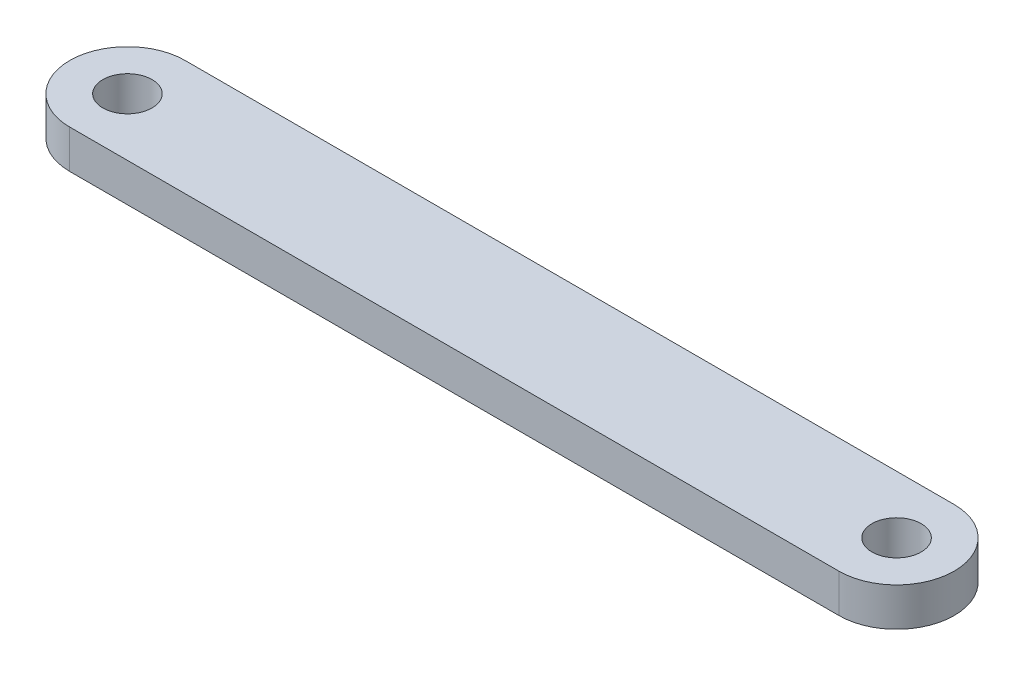
from build123d import *

# Parameters (mm, degrees)
SKETCH1_R           = 2.032
BOSS_EXTRUDE1_DEPTH = 3.175


with BuildPart() as part:
    # Sketch1 → Boss-Extrude1 (new body)
    with BuildSketch(Plane(origin=(0, 0, 0), x_dir=(1, 0, 0), z_dir=(0, 1, 0))):
        with BuildLine():
            Line((0, -4.7625), (-63.5, -4.7625))
            ThreePointArc((-63.5, -4.7625), (-68.2625, 0), (-63.5, 4.7625))
            Line((-63.5, 4.7625), (0, 4.7625))
            ThreePointArc((0, 4.7625), (4.7625, 0), (0, -4.7625))
        make_face()
        with Locations(Location((-63.5, 0, 0), (0, 0, 270))):
            Circle(SKETCH1_R, mode=Mode.SUBTRACT)
        with Locations(Location((0, 0, 0), (0, 0, 270))):
            Circle(SKETCH1_R, mode=Mode.SUBTRACT)
    extrude(amount=BOSS_EXTRUDE1_DEPTH)


solid = part.part
